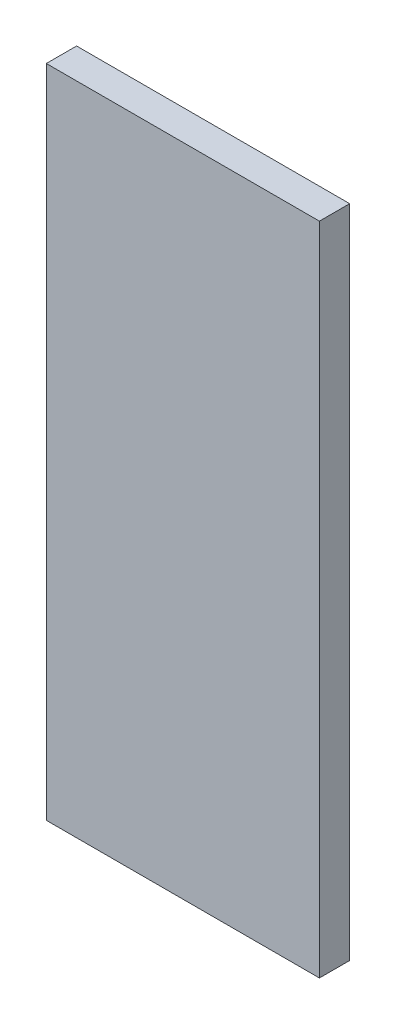
from build123d import *

# Parameters (mm, degrees)
SKETCH1_W           = 535.000000102
SKETCH1_H           = 1650
BOSS_EXTRUDE1_DEPTH = 76.2
SKETCH2_W           = 76.2
SKETCH2_H           = 1650
BOSS_EXTRUDE2_DEPTH = 76.2
SKETCH3_W           = 76.2
SKETCH3_H           = 1650
BOSS_EXTRUDE3_DEPTH = 76.2


with BuildPart() as part:
    # Sketch1 → Boss-Extrude1 (new body)
    with BuildSketch(Plane.XY):
        Rectangle(SKETCH1_W, SKETCH1_H)
    extrude(amount=BOSS_EXTRUDE1_DEPTH)

    # Sketch2 → Boss-Extrude2 (add)
    with BuildSketch(Plane(origin=(267.500000051, 0, 0), x_dir=(0, 0, -1), z_dir=(1, 0, 0))):
        with Locations((-38.1, 0)):
            Rectangle(SKETCH2_W, SKETCH2_H)
    extrude(amount=BOSS_EXTRUDE2_DEPTH)

    # Sketch3 → Boss-Extrude3 (add)
    with BuildSketch(Plane.ZY.offset(267.500000051)):
        with Locations((38.1, 0)):
            Rectangle(SKETCH3_W, SKETCH3_H)
    extrude(amount=BOSS_EXTRUDE3_DEPTH)


solid = part.part
